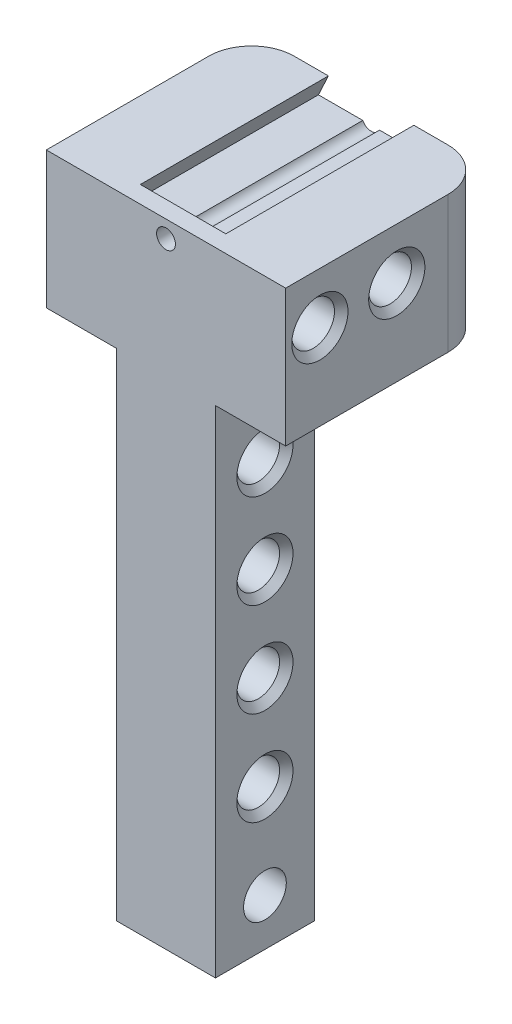
from build123d import *

# Parameters (mm, degrees)
SKETCH1_W                 = 14.7
SKETCH1_H                 = 14.7
BOSS_EXTRUDE1_DEPTH       = 76.2
SKETCH6_R                 = 3.175
CUT_EXTRUDE4_DEPTH        = 78.952244997
CHAMFER5_SIZE             = 1
CHAMFER6_SIZE             = 2.54
SKETCH4_W                 = 35.56
SKETCH4_H                 = 20.32
BOSS_EXTRUDE2_DEPTH       = 30.48
SKETCH5_R                 = 3.175
TRAYSUPPORTMOUNTING_DEPTH = 106.430644976
CHAMFER4_SIZE             = 1
CUT_EXTRUDE5_DEPTH        = 27.94
FILLET1_R                 = 6.35
SKETCH8_R                 = 1.4
CUT_EXTRUDE6_DEPTH        = 103.768035887


with BuildPart() as part:
    # Sketch1 → Boss-Extrude1 (new body)
    with BuildSketch(Plane(origin=(0, 0, 0), x_dir=(1, 0, 0), z_dir=(0, 1, 0))):
        Rectangle(SKETCH1_W, SKETCH1_H)
    extrude(amount=BOSS_EXTRUDE1_DEPTH)

    # Sketch6 → Cut-Extrude4 (cut, through all)
    with BuildSketch(Plane(origin=(7.35, 0, 0), x_dir=(0, 0, -1), z_dir=(1, 0, 0))):
        with Locations((0, 65.405)):
            Circle(SKETCH6_R)
        with Locations((0, 51.435)):
            Circle(SKETCH6_R)
        with Locations((0, 37.465)):
            Circle(SKETCH6_R)
        with Locations((0, 23.495)):
            Circle(SKETCH6_R)
        with Locations((0, 9.525)):
            Circle(SKETCH6_R)
    extrude(amount=-CUT_EXTRUDE4_DEPTH, mode=Mode.SUBTRACT)

    # Chamfer5
    chamfer5_edges = [part.edges().sort_by_distance(p)[0] for p in [
        (-7.35, 65.405, 3.175),
        (7.35, 65.405, 3.175),
        (-7.35, 51.435, 3.175),
        (7.35, 51.435, 3.175),
        (-7.35, 37.465, 3.175),
        (7.35, 37.465, 3.175),
        (-7.35, 23.495, 3.175),
        (7.35, 23.495, 3.175),
    ]]
    chamfer(chamfer5_edges, length=CHAMFER5_SIZE)

    # Chamfer6
    chamfer6_edges = [part.edges().sort_by_distance(p)[0] for p in [
        (0, 0, -7.35),
        (7.35, 0, 0),
        (0, 0, 7.35),
        (-7.35, 0, 0),
    ]]
    chamfer(chamfer6_edges, length=CHAMFER6_SIZE)

    # Sketch4 → Boss-Extrude2 (add)
    with BuildSketch(Plane.XY.offset(7.35)):
        with Locations((0, 86.36)):
            Rectangle(SKETCH4_W, SKETCH4_H)
    extrude(amount=-BOSS_EXTRUDE2_DEPTH)

    # Sketch5 → TraySupportMounting (cut, through all)
    with BuildSketch(Plane(origin=(17.78, 0, 0), x_dir=(0, 0, -1), z_dir=(1, 0, 0))):
        with Locations((9.16, 88.9)):
            Circle(SKETCH5_R)
        with Locations((-2.27, 88.9)):
            Circle(SKETCH5_R)
    extrude(amount=-TRAYSUPPORTMOUNTING_DEPTH, mode=Mode.SUBTRACT)

    # Chamfer4
    chamfer4_edges = [part.edges().sort_by_distance(p)[0] for p in [
        (-17.78, 88.9, -5.985),
        (17.78, 88.9, -5.985),
        (-17.78, 88.9, 5.445),
        (17.78, 88.9, 5.445),
    ]]
    chamfer(chamfer4_edges, length=CHAMFER4_SIZE)

    # Sketch7 → Cut-Extrude5 (cut)
    with BuildSketch(Plane(origin=(0, 0, -23.13), x_dir=(-1, 0, 0), z_dir=(0, 0, -1))):
        Polygon((-6.35, 96.52), (-7.830526815, 93.345), (7.830526815, 93.345), (6.35, 96.52), align=None)
    extrude(amount=-CUT_EXTRUDE5_DEPTH, mode=Mode.SUBTRACT)

    # Fillet1
    fillet1_edges = [part.edges().sort_by_distance(p)[0] for p in [
        (-17.78, 86.36, -23.13),
        (17.78, 86.36, -23.13),
    ]]
    fillet(fillet1_edges, radius=FILLET1_R)

    # Sketch8 → Cut-Extrude6 (cut, through all)
    with BuildSketch(Plane.XY.offset(7.35)):
        with Locations((0, 93.98)):
            Circle(SKETCH8_R)
    extrude(amount=-CUT_EXTRUDE6_DEPTH, mode=Mode.SUBTRACT)


solid = part.part
